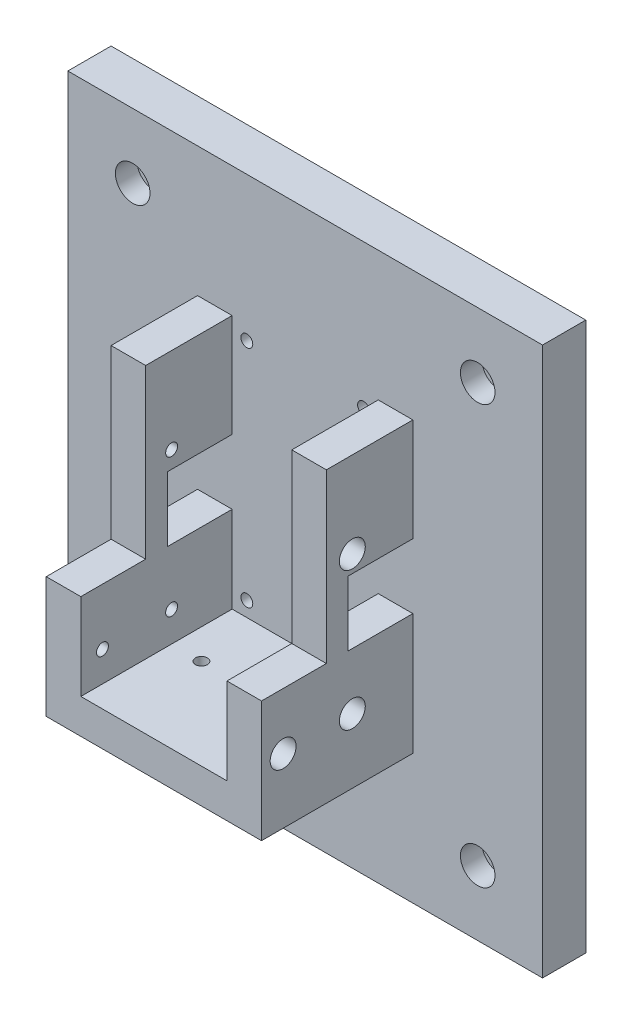
from build123d import *

# Parameters (mm, degrees)
SKETCH1_W               = 58.8
SKETCH1_H               = 8
BOSS_EXTRUDE1_DEPTH     = 25
BOSS_EXTRUDE1_2_DEPTH   = 25
SKETCH1_3_W             = 58.8
SKETCH1_3_H             = 33.8
BOSS_EXTRUDE2_DEPTH     = 5
SKETCH2_R               = 1.375
CUT_EXTRUDE1_DEPTH      = 5
CUT_EXTRUDE2_DEPTH      = 74
CUT_EXTRUDE2_DEPTH_BACK = 20
SKETCH3_R               = 1.375
SKETCH4_W               = 15
SKETCH4_H               = 15
CUT_EXTRUDE3_DEPTH      = 75
SKETCH5_W               = 49.8
SKETCH5_H               = 25
BOSS_EXTRUDE3_DEPTH     = 8
SKETCH6_R               = 1.375
CUT_EXTRUDE4_DEPTH      = 16
BOSS_EXTRUDE4_START     = 5
SKETCH7_W               = 66.8
SKETCH7_H               = 49.8
SKETCH7_R               = 1.375
BOSS_EXTRUDE4_DEPTH     = 5
SKETCH8_W               = 126.8
SKETCH8_H               = 109.8
SKETCH8_W_2             = 66.8
SKETCH8_H_2             = 49.8
BOSS_EXTRUDE5_DEPTH     = 10
BOSS_EXTRUDE6_DEPTH     = 15
SKETCH11_R              = 1.375
CUT_EXTRUDE5_DEPTH      = 55
SKETCH12_R              = 1.625
CUT_EXTRUDE6_DEPTH      = 55
SKETCH13_R              = 3
CUT_EXTRUDE7_DEPTH      = 5
CUT_EXTRUDE8_START      = -5
SKETCH14_R              = 3
CUT_EXTRUDE8_DEPTH      = 5
SKETCH15_R              = 3
CUT_EXTRUDE9_DEPTH      = 7
SKETCH16_R              = 4
CUT_EXTRUDE10_DEPTH     = 5
SKETCH17_R              = 3
CUT_EXTRUDE11_DEPTH     = 5
BODY_MOVE_COPY1_ANGLE   = 120


with BuildPart() as part:
    # Sketch1 → Boss-Extrude1 (new body)
    with BuildSketch(Plane(origin=(0, 0, 0), x_dir=(1, 0, 0), z_dir=(0, 1, 0))):
        with Locations((0, -20.9)):
            Rectangle(SKETCH1_W, SKETCH1_H)
    extrude(amount=BOSS_EXTRUDE1_DEPTH)



with BuildPart() as body_2:
    # Sketch1 → Boss-Extrude1 2 (new body)
    with BuildSketch(Plane(origin=(0, 0, 0), x_dir=(1, 0, 0), z_dir=(0, 1, 0))):
        with Locations((0, 20.9)):
            Rectangle(SKETCH1_W, SKETCH1_H)
    extrude(amount=BOSS_EXTRUDE1_2_DEPTH)


with BuildPart() as part_1:
    add(part.part)

    add(body_2.part)  # Boss-Extrude2 merges body 2
    # Sketch1<3> → Boss-Extrude2 (add)
    with BuildSketch(Plane(origin=(0, 0, 0), x_dir=(1, 0, 0), z_dir=(0, 1, 0))):
        Rectangle(SKETCH1_3_W, SKETCH1_3_H)
    extrude(amount=BOSS_EXTRUDE2_DEPTH)

    # Sketch2 → Cut-Extrude1 (cut)
    with BuildSketch(Plane.XZ):
        with Locations((-26.05, 13.5)):
            Circle(SKETCH2_R)
        with Locations((-26.05, -13.5)):
            Circle(SKETCH2_R)
        with Locations((25.95, -13.5)):
            Circle(SKETCH2_R)
        with Locations((25.95, 13.5)):
            Circle(SKETCH2_R)
    extrude(amount=-CUT_EXTRUDE1_DEPTH, mode=Mode.SUBTRACT)

    # Sketch3 → Cut-Extrude2 (cut, two sides: drawn at the far end of the back side and taken through both)
    with BuildSketch(Plane(origin=(0, 0, 16.9), x_dir=(-1, 0, 0), z_dir=(0, 0, -1)).offset(-CUT_EXTRUDE2_DEPTH_BACK)):
        with Locations((-22.45, 19)):
            Circle(SKETCH3_R)
        with Locations((9.55, 19)):
            Circle(SKETCH3_R)
    extrude(amount=CUT_EXTRUDE2_DEPTH + CUT_EXTRUDE2_DEPTH_BACK, mode=Mode.SUBTRACT)

    # Sketch4 → Cut-Extrude3 (cut)
    with BuildSketch(Plane(origin=(0, 0, -24.9), x_dir=(-1, 0, 0), z_dir=(0, 0, -1))):
        with Locations((-1.9, 12.5)):
            Rectangle(SKETCH4_W, SKETCH4_H)
    extrude(amount=-CUT_EXTRUDE3_DEPTH, mode=Mode.SUBTRACT)

    # Sketch5 → Boss-Extrude3 (add)
    with BuildSketch(Plane(origin=(29.4, 0, 0), x_dir=(0, 0, -1), z_dir=(1, 0, 0))):
        with Locations((0, 12.5)):
            Rectangle(SKETCH5_W, SKETCH5_H)
    extrude(amount=BOSS_EXTRUDE3_DEPTH)

    # Sketch6 → Cut-Extrude4 (cut)
    with BuildSketch(Plane(origin=(37.4, 0, 0), x_dir=(0, 0, -1), z_dir=(1, 0, 0))):
        with Locations((-10, 19)):
            Circle(SKETCH6_R)
        with Locations((10, 19)):
            Circle(SKETCH6_R)
    extrude(amount=-CUT_EXTRUDE4_DEPTH, mode=Mode.SUBTRACT)

    # Sketch7 → Boss-Extrude4 (add)
    with BuildSketch(Plane.XZ.offset(BOSS_EXTRUDE4_START)):
        with Locations((4, 0)):
            Rectangle(SKETCH7_W, SKETCH7_H)
        with Locations((-26.05, 13.5)):
            Circle(SKETCH7_R, mode=Mode.SUBTRACT)
        with Locations((25.95, 13.5)):
            Circle(SKETCH7_R, mode=Mode.SUBTRACT)
        with Locations((25.95, -13.5)):
            Circle(SKETCH7_R, mode=Mode.SUBTRACT)
        with Locations((-26.05, -13.5)):
            Circle(SKETCH7_R, mode=Mode.SUBTRACT)
    extrude(amount=-BOSS_EXTRUDE4_DEPTH)

    # Sketch8 → Boss-Extrude5 (add)
    with BuildSketch(Plane.XZ.offset(5)):
        with Locations((4, 0)):
            Rectangle(SKETCH8_W, SKETCH8_H)
        with Locations((4, 0)):
            Rectangle(SKETCH8_W_2, SKETCH8_H_2, mode=Mode.SUBTRACT)
    extrude(amount=-BOSS_EXTRUDE5_DEPTH)

    # Sketch9 → Boss-Extrude6 (add)
    with BuildSketch(Plane(origin=(0, 25, 0), x_dir=(1, 0, 0), z_dir=(0, 1, 0))):
        Polygon((37.4, -24.9), (37.4, 24.9), (9.4, 24.9), (9.4, 16.9), (29.4, 16.9), (29.4, -16.9), (9.4, -16.9), (9.4, -24.9), align=None)
    extrude(amount=BOSS_EXTRUDE6_DEPTH)

    # Sketch11 → Cut-Extrude5 (cut)
    with BuildSketch(Plane.XY.offset(24.9)):
        with Locations((22.45, 35)):
            Circle(SKETCH11_R)
    extrude(amount=-CUT_EXTRUDE5_DEPTH, mode=Mode.SUBTRACT)

    # Sketch12 → Cut-Extrude6 (cut)
    with BuildSketch(Plane(origin=(0, 5, 0), x_dir=(1, 0, 0), z_dir=(0, 1, 0))):
        with Locations((-44.4, 39.9)):
            Circle(SKETCH12_R)
        with Locations((52.4, 39.9)):
            Circle(SKETCH12_R)
        with Locations((52.4, -39.9)):
            Circle(SKETCH12_R)
        with Locations((-44.4, -39.9)):
            Circle(SKETCH12_R)
    extrude(amount=-CUT_EXTRUDE6_DEPTH, mode=Mode.SUBTRACT)

    # Sketch13 → Cut-Extrude7 (cut)
    with BuildSketch(Plane.XY.offset(24.9)):
        with Locations((-9.55, 19)):
            Circle(SKETCH13_R)
        with Locations((22.45, 35)):
            Circle(SKETCH13_R)
        with Locations((22.45, 19)):
            Circle(SKETCH13_R)
    extrude(amount=-CUT_EXTRUDE7_DEPTH, mode=Mode.SUBTRACT)

    # Sketch14 → Cut-Extrude8 (cut)
    with BuildSketch(Plane(origin=(0, 0, -24.9), x_dir=(-1, 0, 0), z_dir=(0, 0, -1)).offset(CUT_EXTRUDE8_START)):
        with Locations((-22.45, 35)):
            Circle(SKETCH14_R)
        with Locations((-22.45, 19)):
            Circle(SKETCH14_R)
        with Locations((9.55, 19)):
            Circle(SKETCH14_R)
    extrude(amount=CUT_EXTRUDE8_DEPTH, mode=Mode.SUBTRACT)

    # Sketch15 → Cut-Extrude9 (cut)
    with BuildSketch(Plane.XZ.offset(5)):
        with Locations((-26.05, 13.5)):
            Circle(SKETCH15_R)
        with Locations((25.95, 13.5)):
            Circle(SKETCH15_R)
        with Locations((25.95, -13.5)):
            Circle(SKETCH15_R)
        with Locations((-26.05, -13.5)):
            Circle(SKETCH15_R)
    extrude(amount=-CUT_EXTRUDE9_DEPTH, mode=Mode.SUBTRACT)

    # Sketch16 → Cut-Extrude10 (cut)
    with BuildSketch(Plane(origin=(0, 5, 0), x_dir=(1, 0, 0), z_dir=(0, 1, 0))):
        with Locations((-44.4, 39.9)):
            Circle(SKETCH16_R)
        with Locations((52.4, 39.9)):
            Circle(SKETCH16_R)
        with Locations((52.4, -39.9)):
            Circle(SKETCH16_R)
        with Locations((-44.4, -39.9)):
            Circle(SKETCH16_R)
    extrude(amount=-CUT_EXTRUDE10_DEPTH, mode=Mode.SUBTRACT)

    # Sketch17 → Cut-Extrude11 (cut)
    with BuildSketch(Plane(origin=(37.4, 0, 0), x_dir=(0, 0, -1), z_dir=(1, 0, 0))):
        with Locations((-10, 19)):
            Circle(SKETCH17_R)
        with Locations((10, 19)):
            Circle(SKETCH17_R)
    extrude(amount=-CUT_EXTRUDE11_DEPTH, mode=Mode.SUBTRACT)


with BuildPart() as part_2:
    # Body-Move/Copy1: moved
    add(part_1.part.moved(Location((0, 0, 0))).rotate(Axis((8.5, 13, -4.5), (0.5773502691896252, -0.5773502691896272, -0.5773502691896252)), BODY_MOVE_COPY1_ANGLE))


solid = part_2.part
